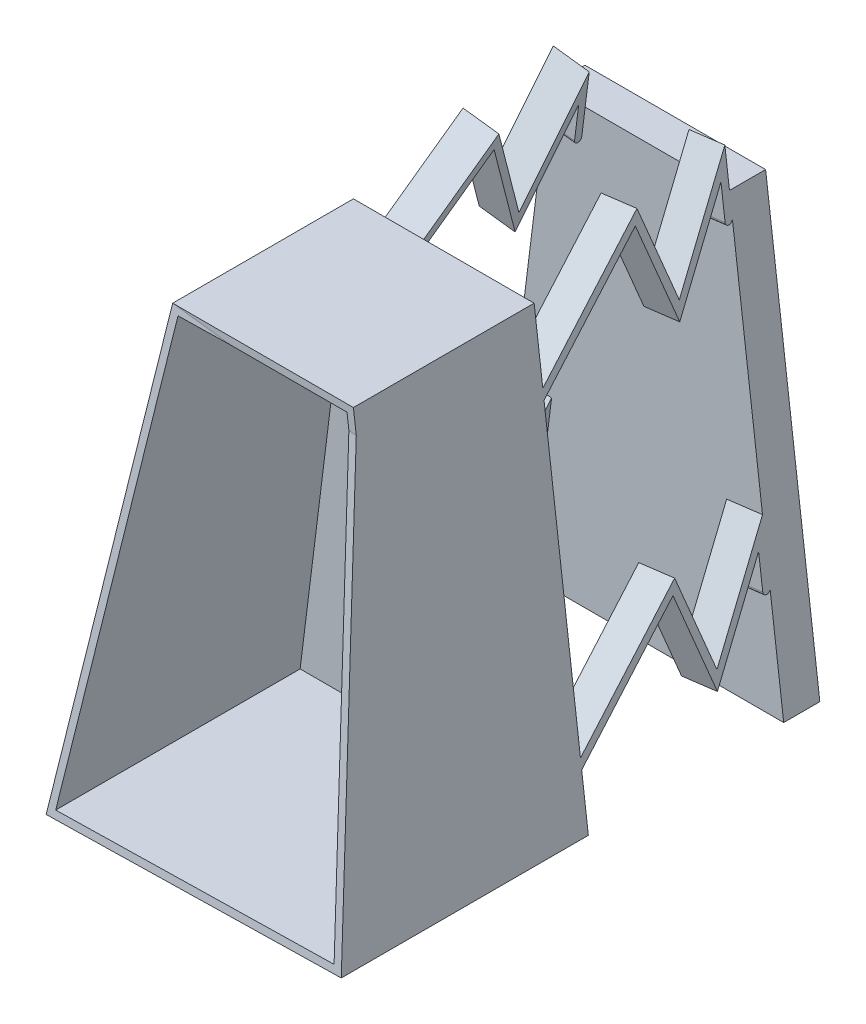
from build123d import *

# Parameters (mm, degrees)
BOSS_EXTRUDE1_DEPTH = 350
SHELL1_T            = -10
CUT_EXTRUDE1_DEPTH  = 436
SKETCH3_W           = 259.761046689
SKETCH3_H           = 96.41009556
CUT_EXTRUDE2_DEPTH  = 653.147409369
BOSS_EXTRUDE2_DEPTH = 50
BOSS_EXTRUDE3_DEPTH = 50
CUT_EXTRUDE3_DEPTH  = 49


with BuildPart() as part:
    # Sketch1 → Boss-Extrude1 (new body)
    with BuildSketch(Plane.XY):
        Polygon((-125, 424.335548173), (125, 424.335548173), (200, -175.664451827), (-200, -175.664451827), align=None)
    extrude(amount=BOSS_EXTRUDE1_DEPTH)

    # Shell1
    shell1_openings = [part.faces().sort_by_distance(p)[0] for p in [
        (0, 101.258625096, 350),
    ]]
    offset(amount=SHELL1_T, openings=shell1_openings, kind=Kind.INTERSECTION)

    # Sketch2 → Cut-Extrude1 (cut)
    with BuildSketch(Plane(origin=(-175.302836698, 21.912854587, 0), x_dir=(0, 0, 1), z_dir=(-0.9922778767136677, 0.12403473458920852, 0))):
        Polygon((250, 405.554434931), (350, -199.114896191), (350, 405.554434931), align=None)
    extrude(amount=-CUT_EXTRUDE1_DEPTH, mode=Mode.SUBTRACT)

    # Sketch3 → Cut-Extrude2 (cut, through all)
    with BuildSketch(Plane(origin=(-175.302836698, 21.912854587, 0), x_dir=(0, 0, 1), z_dir=(-0.9922778767136677, 0.12403473458920852, 0))):
        with Locations((379.880523345, 453.759482711)):
            Rectangle(SKETCH3_W, SKETCH3_H)
    extrude(amount=-CUT_EXTRUDE2_DEPTH, mode=Mode.SUBTRACT)

    # Sketch5 → Boss-Extrude2 (add)
    with BuildSketch(Plane(origin=(-175.302836698, 21.912854587, 0), x_dir=(0, 0, 1), z_dir=(-0.9922778767136677, 0.12403473458920852, 0))):
        with BuildLine():
            Line((0, -124.744929756), (-142.467162168, 5.816018008))
            Line((-142.467162168, 5.816018008), (-187.751575152, -124.744929756))
            Line((-187.751575152, -124.744929756), (-260.206635925, 0))
            Line((-260.206635925, 0), (-260.206635925, -46.209963839))
            ThreePointArc((-260.206635925, -46.209963839), (-265.206635925, -51.209963839), (-270.206635925, -46.209963839))
            Line((-270.206635925, -46.209963839), (-270.206635925, 37.127182563))
            Line((-270.206635925, 37.127182563), (-190.054813406, -100.869161145))
            Line((-190.054813406, -100.869161145), (-146.928792702, 23.468856407))
            Line((-146.928792702, 23.468856407), (6.756291537, -117.372513282))
            ThreePointArc((6.756291537, -117.372513282), (7.064354006, -124.436867288), (0, -124.744929756))
        make_face()
        with BuildLine():
            Line((0, 295.255070244), (-142.467162168, 425.816018008))
            Line((-142.467162168, 425.816018008), (-187.751575152, 295.255070244))
            Line((-187.751575152, 295.255070244), (-260.206635925, 420))
            Line((-260.206635925, 420), (-260.206635925, 373.790036161))
            ThreePointArc((-260.206635925, 373.790036161), (-265.206635925, 368.790036161), (-270.206635925, 373.790036161))
            Line((-270.206635925, 373.790036161), (-270.206635925, 457.127182563))
            Line((-270.206635925, 457.127182563), (-190.054813406, 319.130838855))
            Line((-190.054813406, 319.130838855), (-146.928792702, 443.468856407))
            Line((-146.928792702, 443.468856407), (6.756291537, 302.627486718))
            ThreePointArc((6.756291537, 302.627486718), (7.064354006, 295.563132712), (0, 295.255070244))
        make_face()
    boss_extrude2 = extrude(amount=-BOSS_EXTRUDE2_DEPTH)

    # Mirror1: Boss-Extrude2 across plane
    add(boss_extrude2.mirror(Plane(origin=(0, 0, 0), x_dir=(0, 0, 1), z_dir=(1, 0, 0))))

    # Sketch6 → Boss-Extrude3 (add)
    with BuildSketch(Plane(origin=(0, 0, -270.206635925), x_dir=(-1, 0, 0), z_dir=(0, 0, -1))):
        Polygon((-200, -175.664451827), (-125, 424.335548173), (125, 424.335548173), (200, -175.664451827), align=None)
    extrude(amount=BOSS_EXTRUDE3_DEPTH)

    # Sketch7 → Cut-Extrude3 (cut)
    with BuildSketch(Plane(origin=(0, 0, -320.206635925), x_dir=(-1, 0, 0), z_dir=(0, 0, -1))):
        Polygon((-192.972753686, -170.052955611), (-114.88610452, 414.250591596), (113.988556829, 414.250591596), (190.280110611, -170.052955611), align=None)
    extrude(amount=-CUT_EXTRUDE3_DEPTH, mode=Mode.SUBTRACT)


solid = part.part
